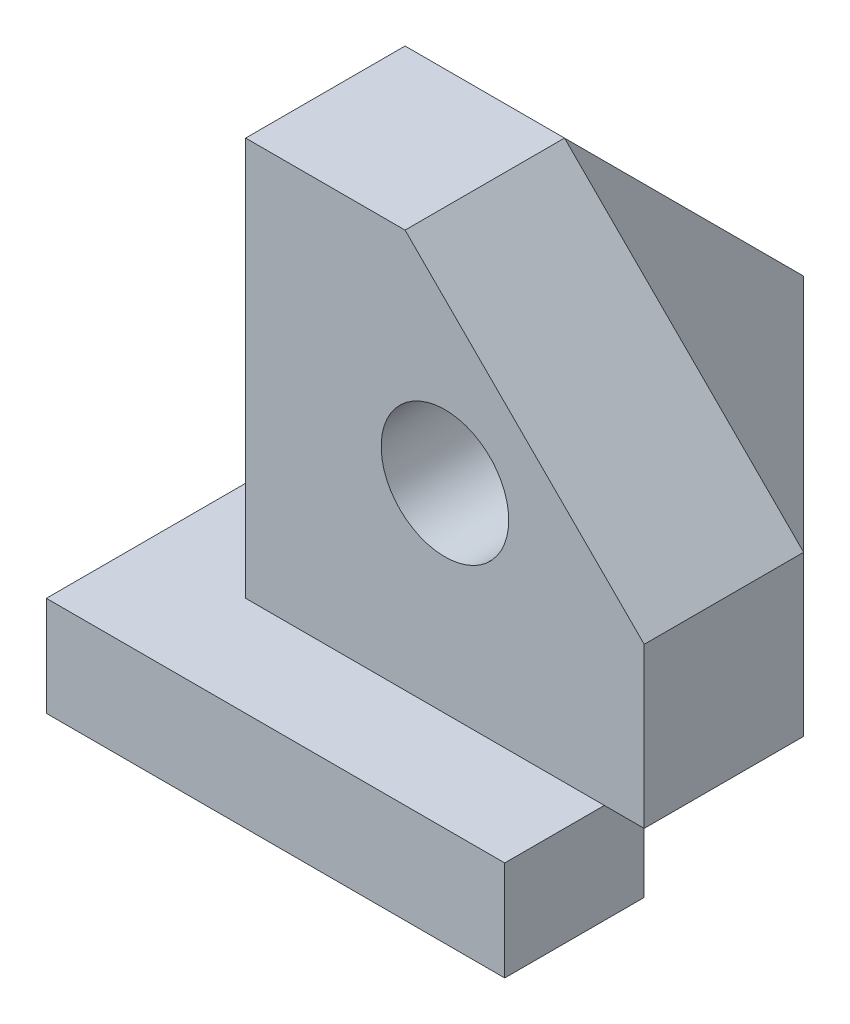
from build123d import *

# Parameters (mm, degrees)
SKETCH1_W           = 10
SKETCH1_H           = 10
BOSS_EXTRUDE1_DEPTH = 10
SKETCH2_R           = 1.6
CUT_EXTRUDE1_DEPTH  = 3.2
SKETCH3_R           = 1.6
CUT_EXTRUDE3_DEPTH  = 3.2
SKETCH4_R           = 1.6
CUT_EXTRUDE4_DEPTH  = 3.2
CHAMFER1_SIZE       = 6
BOSS_EXTRUDE2_DEPTH = 2.5


with BuildPart() as part:
    # Sketch1 → Boss-Extrude1 (new body)
    with BuildSketch(Plane(origin=(0, 0, 0), x_dir=(1, 0, 0), z_dir=(0, 1, 0))):
        Rectangle(SKETCH1_W, SKETCH1_H)
    extrude(amount=BOSS_EXTRUDE1_DEPTH)

    # Sketch2 → Cut-Extrude1 (cut)
    with BuildSketch(Plane.XY.offset(5)):
        with Locations((0, 5)):
            Circle(SKETCH2_R)
    extrude(amount=-CUT_EXTRUDE1_DEPTH, mode=Mode.SUBTRACT)

    # Sketch3 → Cut-Extrude3 (cut)
    with BuildSketch(Plane(origin=(0, 0, 0), x_dir=(-1, 0, 0), z_dir=(0, -1, 0))):
        with Locations(Location((0, 0, 0), (0, 0, 90))):
            Circle(SKETCH3_R)
    extrude(amount=-CUT_EXTRUDE3_DEPTH, mode=Mode.SUBTRACT)

    # Sketch4 → Cut-Extrude4 (cut)
    with BuildSketch(Plane(origin=(-5, 0, 0), x_dir=(0, 0, -1), z_dir=(1, 0, 0))):
        with Locations((0, 5)):
            Circle(SKETCH4_R)
    extrude(amount=CUT_EXTRUDE4_DEPTH, mode=Mode.SUBTRACT)

    # Chamfer1
    chamfer1_edges = [part.edges().sort_by_distance(p)[0] for p in [
        (5, 10, 0),
        (5, 5, -5),
        (0, 10, -5),
    ]]
    chamfer(chamfer1_edges, length=CHAMFER1_SIZE)

    # Sketch5 → Boss-Extrude2 (add)
    with BuildSketch(Plane(origin=(0, -2.5, 0), x_dir=(-1, 0, 0), z_dir=(0, -1, 0))):
        with BuildLine():
            Line((-4, -4), (-4, -7.5))
            Line((-4, -7.5), (7.5, -7.5))
            Line((7.5, -7.5), (7.5, 4))
            Line((7.5, 4), (4, 4))
            Line((4, 4), (4, 0))
            ThreePointArc((4, 0), (2.828427125, -2.828427125), (0, -4))
            Line((0, -4), (-4, -4))
        make_face()
    extrude(amount=-BOSS_EXTRUDE2_DEPTH)


solid = part.part
